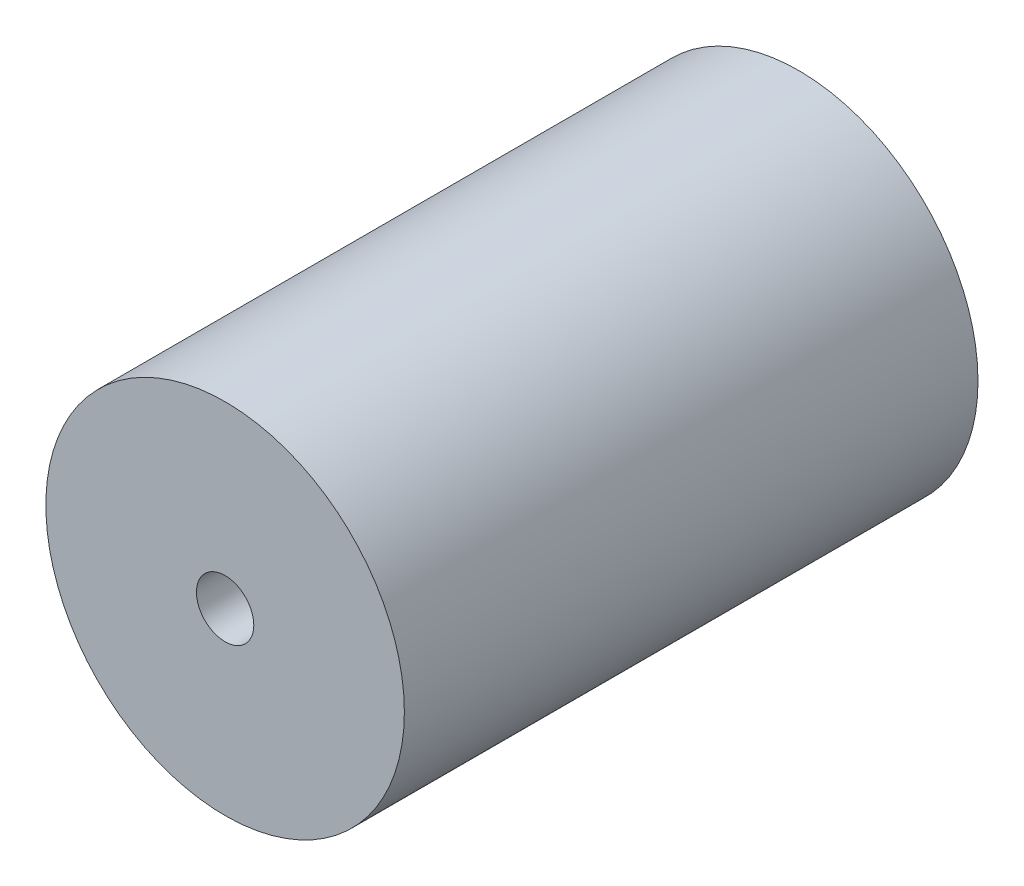
from build123d import *

# Parameters (mm, degrees)
SKETCH_1_R      = 12.5
SKETCH_1_R_2    = 2
EXTRUDE_1_DEPTH = 40


with BuildPart() as part:
    # 草图1 → 凸台-拉伸1 (new body)
    with BuildSketch(Plane.XY):
        Circle(SKETCH_1_R)
        Circle(SKETCH_1_R_2, mode=Mode.SUBTRACT)
    extrude(amount=EXTRUDE_1_DEPTH)


solid = part.part
